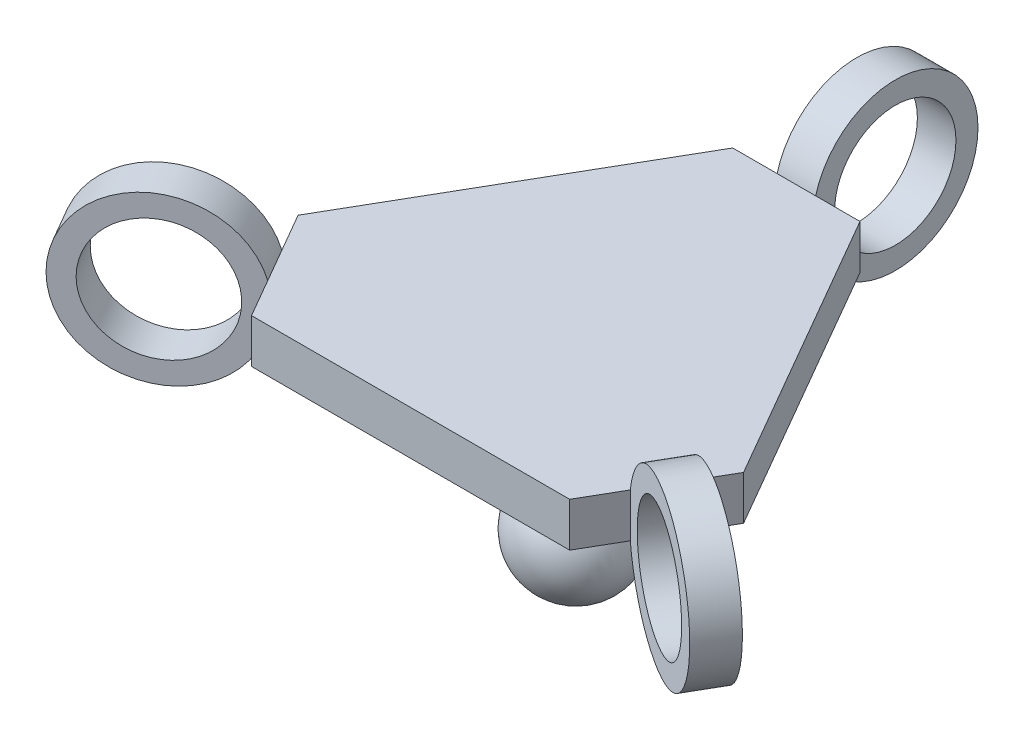
from build123d import *

# Parameters (mm, degrees)
BOSS_EXTRUDE1_DEPTH      = 8
SKETCH2_R                = 5
CUT_EXTRUDE1_DEPTH       = 107
BOSS_EXTRUDE2_DEPTH      = 3.5
BOSS_EXTRUDE2_DEPTH_BACK = 3.5
SKETCH3_R                = 15
SKETCH4_R                = 11
CUT_EXTRUDE2_DEPTH       = 19.5
CIRPATTERN1_COUNT        = 3
SKETCH6_R                = 5
BOSS_EXTRUDE3_DEPTH      = 34


with BuildPart() as part:
    # Sketch1 → Boss-Extrude1 (new body)
    with BuildSketch(Plane(origin=(0, 0, 0), x_dir=(1, 0, 0), z_dir=(0, 1, 0))):
        Polygon((-11.547005384, 40), (-40.414518843, -10), (-28.867513459, -30), (28.867513459, -30), (40.414518843, -10), (11.547005384, 40), align=None)
    extrude(amount=BOSS_EXTRUDE1_DEPTH)

    # Sketch2 → Cut-Extrude1 (cut)
    with BuildSketch(Plane(origin=(0, 8, 0), x_dir=(1, 0, 0), z_dir=(0, 1, 0))):
        Circle(SKETCH2_R)
    extrude(amount=-CUT_EXTRUDE1_DEPTH, mode=Mode.SUBTRACT)

    # Sketch3 → Boss-Extrude2 (add, two sides: drawn at the far end of the back side and taken through both)
    with BuildSketch(Plane(origin=(0, 0, 0), x_dir=(0, 0, -1), z_dir=(1, 0, 0)).offset(-BOSS_EXTRUDE2_DEPTH_BACK)):
        with Locations((54.454926612, 4.00688116)):
            Circle(SKETCH3_R)
    extrude(amount=BOSS_EXTRUDE2_DEPTH + BOSS_EXTRUDE2_DEPTH_BACK)

    # Sketch4 → Cut-Extrude2 (cut)
    with BuildSketch(Plane(origin=(3.5, 0, 0), x_dir=(0, 0, -1), z_dir=(1, 0, 0))):
        with Locations((54.454926612, 4.00688116)):
            Circle(SKETCH4_R)
    extrude(amount=-CUT_EXTRUDE2_DEPTH, mode=Mode.SUBTRACT)


with BuildPart() as cirpattern1_1:
    # CirPattern1: pattern copy
    add(part.part.rotate(Axis((0, -99, 0), (0, 1, 0)), 1 * 360 / CIRPATTERN1_COUNT))


with BuildPart() as cirpattern1_2:
    # CirPattern1: pattern copy
    add(part.part.rotate(Axis((0, -99, 0), (0, 1, 0)), 2 * 360 / CIRPATTERN1_COUNT))


with BuildPart() as part_1:
    add(part.part)

    add(cirpattern1_1.part)  # Boss-Extrude3 merges CirPattern1_1

    add(cirpattern1_2.part)  # Boss-Extrude3 merges CirPattern1_2
    # Sketch6 → Boss-Extrude3 (add)
    with BuildSketch(Plane(origin=(0, 8, 0), x_dir=(1, 0, 0), z_dir=(0, 1, 0))):
        Circle(SKETCH6_R)
    extrude(amount=-BOSS_EXTRUDE3_DEPTH)


with BuildPart() as body_2:
    # Sketch8 → Revolve1 (revolve)
    with BuildSketch(Plane(origin=(0, -26, 0), x_dir=(-1, 0, 0), z_dir=(0, -1, 0))):
        with BuildLine():
            Line((0, 10), (0, -10))
            ThreePointArc((0, -10), (10, 0), (0, 10))
        make_face()
    revolve(axis=Axis((0, -26, 0), (0, 0, -1)))


solid = Compound([part_1.part, body_2.part])
